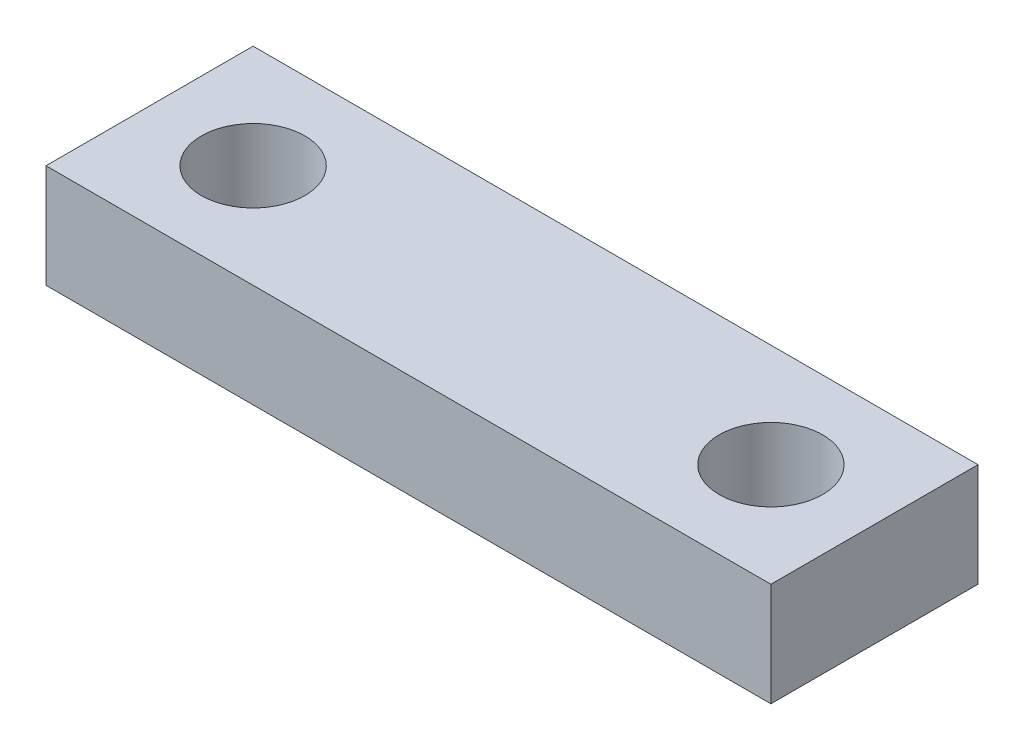
from build123d import *

# Parameters (mm, degrees)
SKETCH1_W           = 17.78
SKETCH1_H           = 5.08
SKETCH1_R           = 1.27
BOSS_EXTRUDE1_DEPTH = 2.54


with BuildPart() as part:
    # Sketch1 → Boss-Extrude1 (new body)
    with BuildSketch(Plane(origin=(0, 0, 0), x_dir=(1, 0, 0), z_dir=(0, 1, 0))):
        with Locations((8.89, 2.54)):
            Rectangle(SKETCH1_W, SKETCH1_H)
        with Locations(Location((2.54, 2.54, 0), (0, 0, 270))):
            Circle(SKETCH1_R, mode=Mode.SUBTRACT)
        with Locations(Location((15.24, 2.54, 0), (0, 0, 270))):
            Circle(SKETCH1_R, mode=Mode.SUBTRACT)
    extrude(amount=BOSS_EXTRUDE1_DEPTH)


solid = part.part
